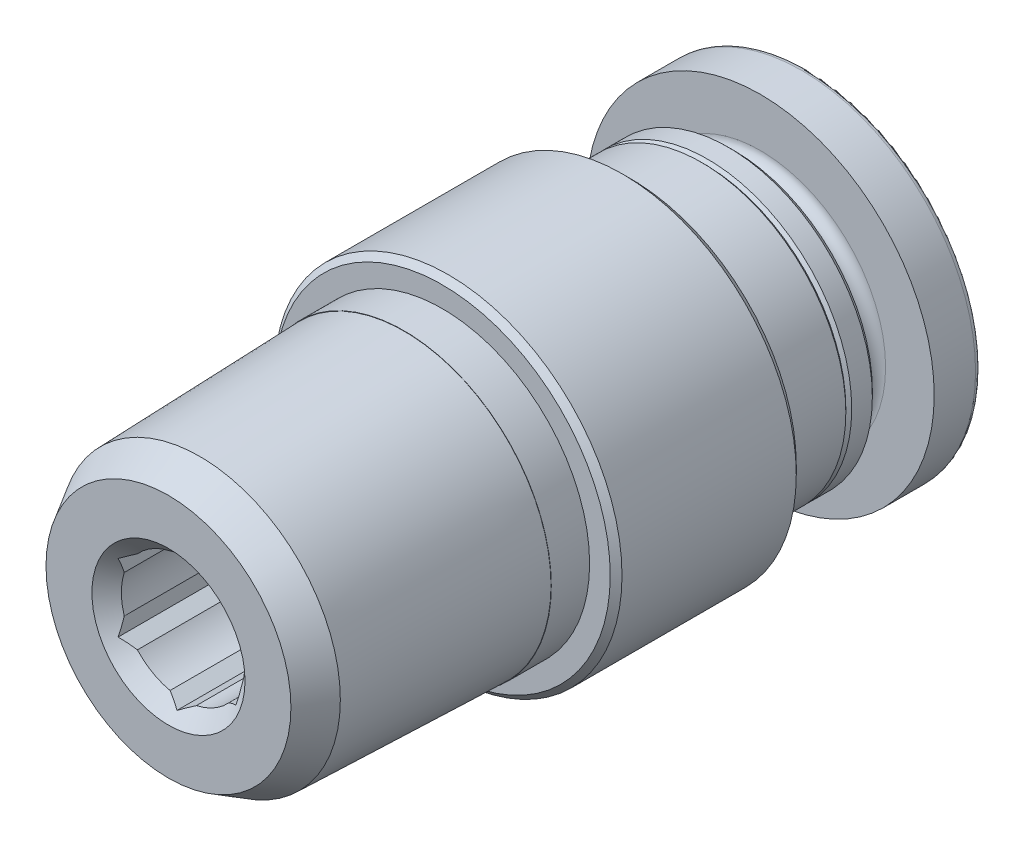
from build123d import *

# Parameters (mm, degrees)
CUT_EXTRUDE1_DEPTH = 5.1


with BuildPart() as part:
    # Sketch1 → Revolve1 (revolve)
    with BuildSketch(Plane(origin=(0, 0, 0), x_dir=(0, 0, -1), z_dir=(1, 0, 0)), mode=Mode.PRIVATE) as revolve1_sk:
        with BuildLine():
            Line((0, 0), (0, 5.9))
            Line((0, 5.9), (7.417157288, 5.9))
            Line((7.417157288, 5.9), (7.7, 5.617157288))
            Line((7.7, 5.617157288), (7.7, 4.9))
            Line((7.7, 4.9), (10.1, 4.9))
            Line((10.1, 4.9), (10.2, 4.8))
            Line((10.2, 4.8), (10.3, 4.9))
            Line((10.3, 4.9), (11, 4.9))
            Line((11, 4.9), (11.2, 4.7))
            Line((11.2, 4.7), (11.2, 3.875))
            Line((11.2, 3.875), (11.725, 3.875))
            ThreePointArc((11.725, 3.875), (11.990165043, 3.984834957), (12.1, 4.25))
            Line((12.1, 4.25), (12.1, 5.9))
            Line((12.1, 5.9), (13.504587146, 5.9))
            ThreePointArc((13.504587146, 5.9), (13.633144667, 5.853208889), (13.701548696, 5.734729636))
            Line((13.701548696, 5.734729636), (14.1, 3.475))
            Line((14.1, 3.475), (14.1, 0))
            Line((14.1, 0), (0, 0))
        make_face()
    revolve(revolve1_sk.sketch.rotate(Axis((0, 0, -14.1), (0, 0, 1)), 270), axis=Axis((0, 0, -14.1), (0, 0, 1)))

    # Sketch2 → Revolve2 (revolve)
    with BuildSketch(Plane(origin=(0, 0, 0), x_dir=(0, 0, -1), z_dir=(1, 0, 0)), mode=Mode.PRIVATE) as revolve2_sk:
        Polygon((-8, 0), (-8, 4.158121832), (-6.93615215, 4.772334675), (0, 4.988878168), (0, 0), align=None)
    revolve(revolve2_sk.sketch.rotate(Axis((0, 0, 0), (0, 0, 1)), 270), axis=Axis((0, 0, 0), (0, 0, 1)))

    # Sketch3 → Cut-Revolve1 (revolve, cut)
    with BuildSketch(Plane(origin=(0, 0, 0), x_dir=(0, 0, -1), z_dir=(1, 0, 0)), mode=Mode.PRIVATE) as cut_revolve1_sk:
        Polygon((0, 5.9), (0, 5), (1.3, 5), (1.3, 5.7), (1.5, 5.9), align=None)
    revolve(cut_revolve1_sk.sketch.rotate(Axis((0, 0, -50), (0, 0, 1)), 270), axis=Axis((0, 0, -50), (0, 0, 1)), mode=Mode.SUBTRACT)

    # Sketch4 → Cut-Revolve2 (revolve, cut)
    with BuildSketch(Plane(origin=(0, 0, 0), x_dir=(0, 0, -1), z_dir=(1, 0, 0)), mode=Mode.PRIVATE) as cut_revolve2_sk:
        with BuildLine():
            Line((-8, 0), (-8, 2.6))
            Line((-8, 2.6), (-7.5, 2.1))
            Line((-7.5, 2.1), (-2.9, 2.1))
            Line((-2.9, 2.1), (-2.9, 3.175))
            Line((-2.9, 3.175), (13.8, 3.175))
            ThreePointArc((13.8, 3.175), (14.012132034, 3.262867966), (14.1, 3.475))
            Line((14.1, 3.475), (14.1, 0))
            Line((14.1, 0), (-8, 0))
        make_face()
    revolve(cut_revolve2_sk.sketch.rotate(Axis((0, 0, -14.1), (0, 0, 1)), 270), axis=Axis((0, 0, -14.1), (0, 0, 1)), mode=Mode.SUBTRACT)

    # Sketch5 → Cut-Extrude1 (cut)
    with BuildSketch(Plane.XY.offset(2.9)):
        Polygon((-2, -1.154700538), (0, -2.309401077), (2, -1.154700538), (2, 1.154700538), (0, 2.309401077), (-2, 1.154700538), align=None)
    extrude(amount=CUT_EXTRUDE1_DEPTH, mode=Mode.SUBTRACT)


solid = part.part
